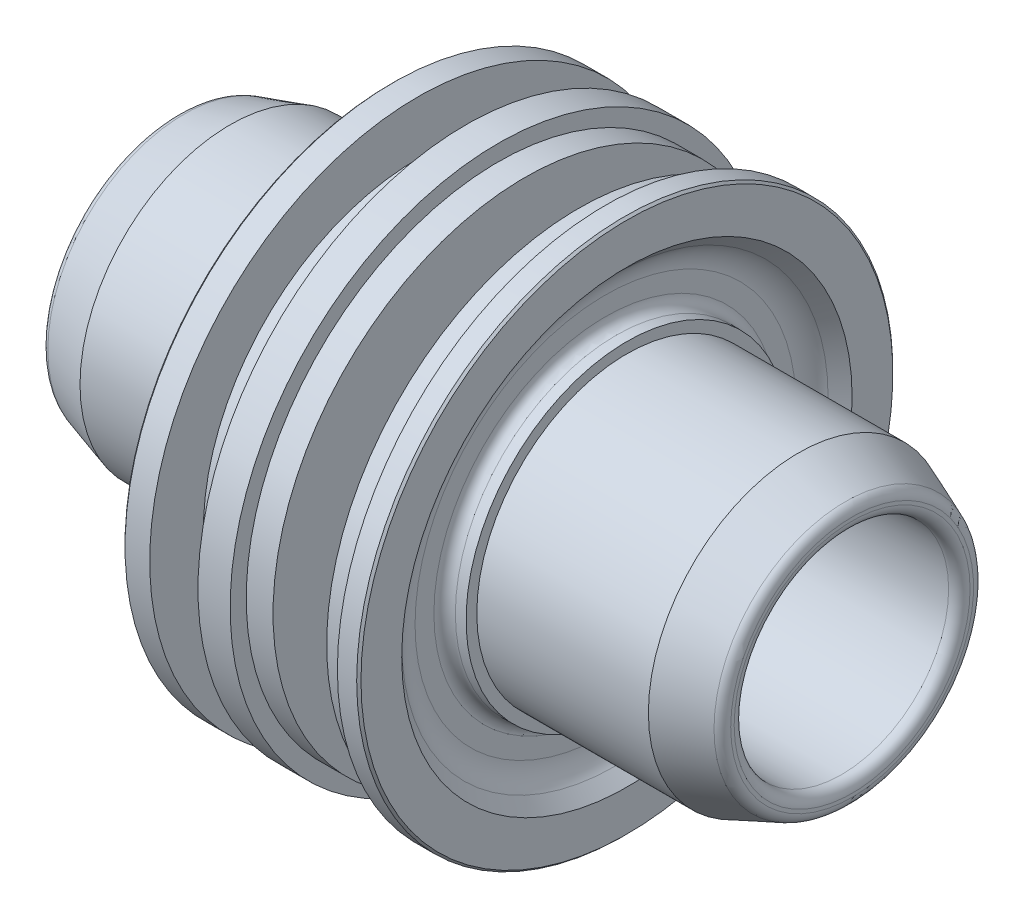
from build123d import *

# Parameters (mm, degrees)
SZKIC2_W         = 4.5
SZKIC2_H         = 5
ZAOKR_GLENIE1_R  = 1
ZAOKR_GLENIE2_R  = 0.5
ZAOKR_GLENIE3_R  = 1
ZAOKR_GLENIE4_R  = 3
ZAOKR_GLENIE5_R  = 0.5
SFAZOWANIE1_SIZE = 0.2


with BuildPart() as part:
    # Szkic1 → Obrót1 (revolve)
    with BuildSketch(Plane.XY, mode=Mode.PRIVATE) as obr_t1_sk:
        Polygon((0, 6), (21, 6), (21, 10), (46, 10), (46, 12), (41, 14), (25, 14), (25, 25), (3, 25), (3, 14), (-12, 14), (-17, 12.5), (-17, 10), (0, 10), align=None)
    revolve(obr_t1_sk.sketch.rotate(Axis((-28.280163409, 0, 0), (1, 0, 0)), 90), axis=Axis((-28.280163409, 0, 0), (1, 0, 0)))

    # Szkic2 → Wycięcie-obrót1 (revolve, cut)
    with BuildSketch(Plane.XY, mode=Mode.PRIVATE) as wyci_cie_obr_t1_sk:
        Polygon((3, 15), (10.5, 15), (9.934652445, 17.223788184), (8.333235178, 17.768270055), (3, 18), align=None)
        Polygon((20.5, 23.5), (23, 23.5), (23, 25), (13, 25), (13, 23.5), (15.5, 23.5), (15.5, 15), (20.5, 15), align=None)
        with Locations((7.75, 22.5)):
            Rectangle(SZKIC2_W, SZKIC2_H)
        Polygon((25, 15), (23, 15), (23, 19), (25, 21), align=None)
    revolve(wyci_cie_obr_t1_sk.sketch.rotate(Axis((25, 0, 0), (-1, 0, 0)), 90), axis=Axis((25, 0, 0), (-1, 0, 0)), mode=Mode.SUBTRACT)

    # Zaokrąglenie1
    zaokr_glenie1_edges = [part.edges().sort_by_distance(p)[0] for p in [
        (-17, 0, -10),
        (-17, 0, -12.5),
        (46, 0, -12),
        (46, 0, -10),
    ]]
    fillet(zaokr_glenie1_edges, radius=ZAOKR_GLENIE1_R)

    # Zaokrąglenie2
    zaokr_glenie2_edges = [part.edges().sort_by_distance(p)[0] for p in [
        (0, 0, -10),
        (21, 0, -10),
    ]]
    fillet(zaokr_glenie2_edges, radius=ZAOKR_GLENIE2_R)

    # Zaokrąglenie3
    zaokr_glenie3_edges = [part.edges().sort_by_distance(p)[0] for p in [
        (23, 0, 15),
    ]]
    fillet(zaokr_glenie3_edges, radius=ZAOKR_GLENIE3_R)

    # Zaokrąglenie4
    zaokr_glenie4_edges = [part.edges().sort_by_distance(p)[0] for p in [
        (23, 0, 19),
    ]]
    fillet(zaokr_glenie4_edges, radius=ZAOKR_GLENIE4_R)

    # Zaokrąglenie5
    zaokr_glenie5_edges = [part.edges().sort_by_distance(p)[0] for p in [
        (10.5, 0, 15),
        (9.934652445, 0, 17.223788184),
        (8.333235178, 0, 17.768270055),
    ]]
    fillet(zaokr_glenie5_edges, radius=ZAOKR_GLENIE5_R)

    # Sfazowanie1
    sfazowanie1_edges = [part.edges().sort_by_distance(p)[0] for p in [
        (3, 0, -25),
        (25, 0, -25),
    ]]
    chamfer(sfazowanie1_edges, length=SFAZOWANIE1_SIZE)


solid = part.part
